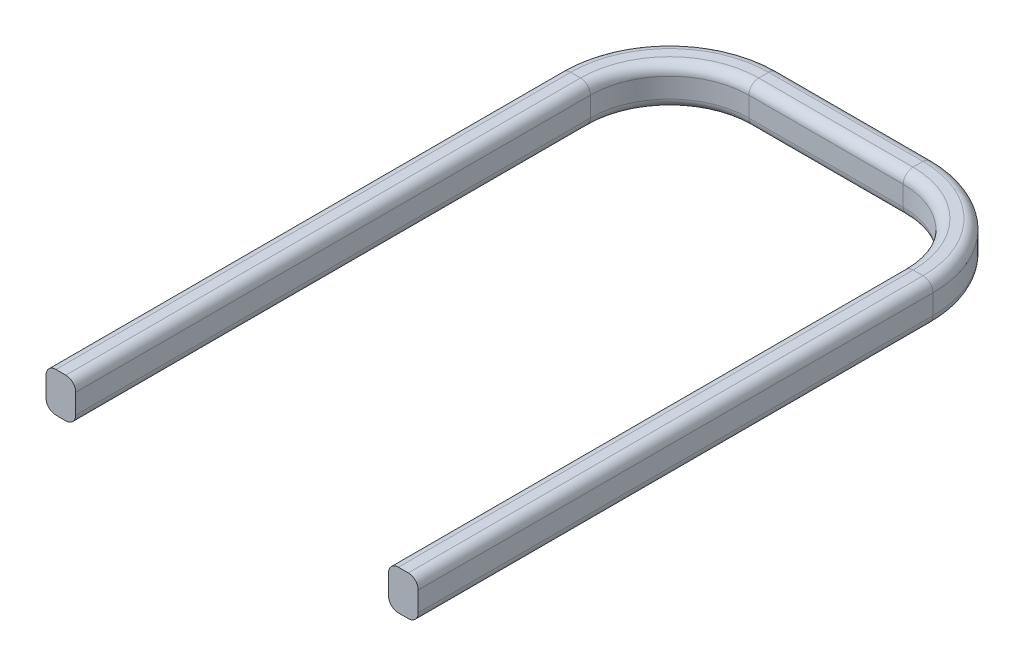
from build123d import *

# Parameters (mm, degrees)
SKETCH_5_W = 0.75
SKETCH_5_H = 1
FILLET_1_R = 0.25


with BuildPart() as part:
    # 扫描1: sweep along a path in 草图3
    with BuildLine(Plane(origin=(0, 0, 0), x_dir=(1, 0, 0), z_dir=(0, 1, 0))) as sweep_1_path:
        Line((-3.95, 0), (-3.95, 13))
        ThreePointArc((-3.95, 13), (-3.364213562, 14.414213562), (-1.95, 15))
        Line((-1.95, 15), (1.95, 15))
        ThreePointArc((1.95, 15), (3.364213562, 14.414213562), (3.95, 13))
        Line((3.95, 13), (3.95, 0))
    # 草图5 → 扫描1 (sweep)
    with BuildSketch(Plane.XY):
        with Locations((-4.325, 0.5)):
            Rectangle(SKETCH_5_W, SKETCH_5_H)
    sweep(path=sweep_1_path.line)

    # 圆角1
    fillet_1_edges = [part.edges().sort_by_distance(p)[0] for p in [
        (3.95, 1, -6.5),
        (4.7, 1, -6.5),
        (4.7, 0, -6.5),
        (-3.95, 0, -6.5),
        (-3.95, 1, -6.5),
        (-4.7, 1, -6.5),
        (-4.7, 0, -6.5),
        (-3.364213562, 0, -14.414213562),
        (-3.364213562, 1, -14.414213562),
        (-3.894543648, 1, -14.944543648),
        (-3.894543648, 0, -14.944543648),
        (0, 0, -15),
        (0, 1, -15),
        (0, 1, -15.75),
        (0, 0, -15.75),
        (3.364213562, 0, -14.414213562),
        (3.364213562, 1, -14.414213562),
        (3.894543648, 1, -14.944543648),
        (3.894543648, 0, -14.944543648),
        (3.95, 0, -6.5),
    ]]
    fillet(fillet_1_edges, radius=FILLET_1_R)


solid = part.part
